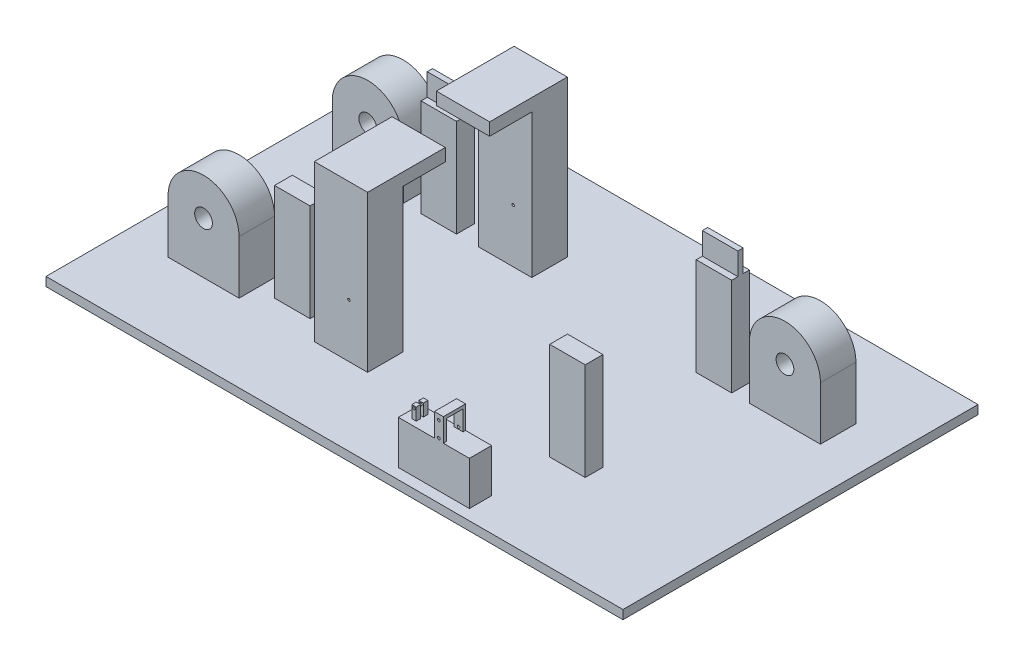
from build123d import *

# Parameters (mm, degrees)
ESQUISSE2_W             = 650
ESQUISSE2_H             = 400
BOSS_EXTRU_1_DEPTH      = 5
ESQUISSE3_W             = 80
ESQUISSE3_H             = 40
BOSS_EXTRU_3_DEPTH      = 100
CONG_2_RADIUS           = 40
CONG_2_LENGTH           = 40
CONG_3_RADIUS           = 40
CONG_3_LENGTH           = 40
CONG_4_RADIUS           = 40
CONG_4_LENGTH           = 40
ESQUISSE6_R             = 10
ENL_V_MAT_EXTRU_2_DEPTH = 463.932230461
ESQUISSE7_R             = 10
ENL_V_MAT_EXTRU_3_DEPTH = 463.932230461
ESQUISSE9_W             = 80
ESQUISSE9_H             = 25
BOSS_EXTRU_4_DEPTH      = 49
ESQUISSE10_W            = 10.1
ESQUISSE10_H            = 3.4
BOSS_EXTRU_5_DEPTH      = 26
ENL_V_MAT_EXTRU_4_REACH = 518.908
ESQUISSE11_R            = 1.5
ESQUISSE12_W            = 10.1
ESQUISSE12_H            = 3.5
BOSS_EXTRU_6_DEPTH      = 21.6
ESQUISSE13_W            = 10.1
ESQUISSE13_H            = 2.8
BOSS_EXTRU_7_DEPTH      = 26
ENL_V_MAT_EXTRU_5_REACH = 500.416
ESQUISSE14_R            = 1.5
ESQUISSE15_W            = 5
ESQUISSE15_H            = 5
BOSS_EXTRU_8_DEPTH      = 13.75
ESQUISSE16_R            = 1.4
ENL_V_MAT_EXTRU_6_DEPTH = 513.19614407
ESQUISSE17_W            = 40
ESQUISSE17_H            = 20
BOSS_EXTRU_9_DEPTH      = 110
ESQUISSE18_W            = 40
ESQUISSE18_H            = 6
BOSS_EXTRU_10_DEPTH     = 25
ESQUISSE20_W            = 60
ESQUISSE20_H            = 40
BOSS_EXTRU_11_DEPTH     = 175.7
BOSS_EXTRU_12_REACH     = 463.014
ESQUISSE21_W            = 60
ESQUISSE21_H            = 14.1
ENL_V_MAT_EXTRU_7_REACH = 426.393
ESQUISSE22_W            = 60
ESQUISSE22_H            = 50


with BuildPart() as part:
    # Esquisse2 → Boss.-Extru.1 (new, symmetric)
    with BuildSketch(Plane(origin=(0, 0, 0), x_dir=(1, 0, 0), z_dir=(0, 1, 0))):
        Rectangle(ESQUISSE2_W, ESQUISSE2_H)
    extrude(amount=BOSS_EXTRU_1_DEPTH, both=True)

    # Esquisse3 → Boss.-Extru.3 (add)
    with BuildSketch(Plane(origin=(0, 5, 0), x_dir=(1, 0, 0), z_dir=(0, 1, 0))):
        with Locations((-235, -92.5)):
            Rectangle(ESQUISSE3_W, ESQUISSE3_H)
        with Locations((235, 92.5)):
            Rectangle(ESQUISSE3_W, ESQUISSE3_H)
        with Locations((-235, 92.5)):
            Rectangle(ESQUISSE3_W, ESQUISSE3_H)
    extrude(amount=BOSS_EXTRU_3_DEPTH)

    # Congé2: full round fillet: the end face becomes a half cylinder, R = half its width
    cong_2_face = Plane((-235, 105, 92.5), x_dir=(0, 0, -1), z_dir=(0, 1, 0))  # on the end face: x along it, z out of the body
    cong_2_slab = cong_2_face.offset(-CONG_2_RADIUS / 2) * Box(CONG_2_LENGTH, 2 * CONG_2_RADIUS, CONG_2_RADIUS, mode=Mode.PRIVATE)  # the body's end, R deep
    cong_2_round = Plane((-235, 65, 92.5), x_dir=(0, 1, 0), z_dir=(0, 0, -1)) * Cylinder(CONG_2_RADIUS, CONG_2_LENGTH, mode=Mode.PRIVATE)  # its axis R under the face
    add(cong_2_slab - cong_2_round, mode=Mode.SUBTRACT)

    # Congé3: full round fillet: the end face becomes a half cylinder, R = half its width
    cong_3_face = Plane((-235, 105, -92.5), x_dir=(0, 0, -1), z_dir=(0, 1, 0))  # on the end face: x along it, z out of the body
    cong_3_slab = cong_3_face.offset(-CONG_3_RADIUS / 2) * Box(CONG_3_LENGTH, 2 * CONG_3_RADIUS, CONG_3_RADIUS, mode=Mode.PRIVATE)  # the body's end, R deep
    cong_3_round = Plane((-235, 65, -92.5), x_dir=(0, 1, 0), z_dir=(0, 0, -1)) * Cylinder(CONG_3_RADIUS, CONG_3_LENGTH, mode=Mode.PRIVATE)  # its axis R under the face
    add(cong_3_slab - cong_3_round, mode=Mode.SUBTRACT)

    # Congé4: full round fillet: the end face becomes a half cylinder, R = half its width
    cong_4_face = Plane((235, 105, -92.5), x_dir=(0, 0, -1), z_dir=(0, 1, 0))  # on the end face: x along it, z out of the body
    cong_4_slab = cong_4_face.offset(-CONG_4_RADIUS / 2) * Box(CONG_4_LENGTH, 2 * CONG_4_RADIUS, CONG_4_RADIUS, mode=Mode.PRIVATE)  # the body's end, R deep
    cong_4_round = Plane((235, 65, -92.5), x_dir=(0, 1, 0), z_dir=(0, 0, -1)) * Cylinder(CONG_4_RADIUS, CONG_4_LENGTH, mode=Mode.PRIVATE)  # its axis R under the face
    add(cong_4_slab - cong_4_round, mode=Mode.SUBTRACT)

    # Esquisse6 → Enlèv. mat.-Extru.2 (cut, through all)
    with BuildSketch(Plane.XY.offset(112.5)):
        with Locations((-235, 63)):
            Circle(ESQUISSE6_R)
    extrude(amount=-ENL_V_MAT_EXTRU_2_DEPTH, mode=Mode.SUBTRACT)

    # Esquisse7 → Enlèv. mat.-Extru.3 (cut, through all)
    with BuildSketch(Plane(origin=(0, 0, -112.5), x_dir=(-1, 0, 0), z_dir=(0, 0, -1))):
        with Locations((-235, 63)):
            Circle(ESQUISSE7_R)
    extrude(amount=-ENL_V_MAT_EXTRU_3_DEPTH, mode=Mode.SUBTRACT)

    # Esquisse9 → Boss.-Extru.4 (add)
    with BuildSketch(Plane(origin=(0, 5, 0), x_dir=(1, 0, 0), z_dir=(0, 1, 0))):
        with Locations((100, -175.5)):
            Rectangle(ESQUISSE9_W, ESQUISSE9_H)
    extrude(amount=BOSS_EXTRU_4_DEPTH)

    # Esquisse10 → Boss.-Extru.5 (add)
    with BuildSketch(Plane(origin=(0, 54, 0), x_dir=(1, 0, 0), z_dir=(0, 1, 0))):
        with Locations((105.62, -186.3)):
            Rectangle(ESQUISSE10_W, ESQUISSE10_H)
    extrude(amount=BOSS_EXTRU_5_DEPTH)

    # Esquisse11 → Enlèv. mat.-Extru.4 (cut, up to next)
    with BuildSketch(Plane.XY.offset(188), mode=Mode.PRIVATE) as enl_v_mat_extru_4_sk1:
        with Locations((105.62, 56.5)):
            Circle(ESQUISSE11_R)
    enl_v_mat_extru_4_tool1 = extrude(enl_v_mat_extru_4_sk1.sketch, amount=-ENL_V_MAT_EXTRU_4_REACH, mode=Mode.PRIVATE) & part.part
    # Esquisse11 → Enlèv. mat.-Extru.4 (cut, up to next)
    with BuildSketch(Plane.XY.offset(188), mode=Mode.PRIVATE) as enl_v_mat_extru_4_sk2:
        with Locations((105.62, 74)):
            Circle(ESQUISSE11_R)
    enl_v_mat_extru_4_tool2 = extrude(enl_v_mat_extru_4_sk2.sketch, amount=-ENL_V_MAT_EXTRU_4_REACH, mode=Mode.PRIVATE) & part.part
    add(enl_v_mat_extru_4_tool1.solids().sort_by_distance((105.62, 56.5, 188))[0], mode=Mode.SUBTRACT)
    add(enl_v_mat_extru_4_tool2.solids().sort_by_distance((105.62, 74, 188))[0], mode=Mode.SUBTRACT)

    # Esquisse12 → Boss.-Extru.6 (add)
    with BuildSketch(Plane(origin=(0, 0, 184.6), x_dir=(-1, 0, 0), z_dir=(0, 0, -1))):
        with Locations((-105.62, 78.25)):
            Rectangle(ESQUISSE12_W, ESQUISSE12_H)
    extrude(amount=BOSS_EXTRU_6_DEPTH)

    # Esquisse13 → Boss.-Extru.7 (add)
    with BuildSketch(Plane(origin=(0, 80, 0), x_dir=(1, 0, 0), z_dir=(0, 1, 0))):
        with Locations((105.62, -164.4)):
            Rectangle(ESQUISSE13_W, ESQUISSE13_H)
    extrude(amount=-BOSS_EXTRU_7_DEPTH)

    # Esquisse14 → Enlèv. mat.-Extru.5 (cut, up to next)
    with BuildSketch(Plane(origin=(0, 0, 163), x_dir=(-1, 0, 0), z_dir=(0, 0, -1)), mode=Mode.PRIVATE) as enl_v_mat_extru_5_sk1:
        with Locations(Location((-105.62, 74, 0), (0, 0, 180))):
            Circle(ESQUISSE14_R)
    enl_v_mat_extru_5_tool1 = extrude(enl_v_mat_extru_5_sk1.sketch, amount=-ENL_V_MAT_EXTRU_5_REACH, mode=Mode.PRIVATE) & part.part
    # Esquisse14 → Enlèv. mat.-Extru.5 (cut, up to next)
    with BuildSketch(Plane(origin=(0, 0, 163), x_dir=(-1, 0, 0), z_dir=(0, 0, -1)), mode=Mode.PRIVATE) as enl_v_mat_extru_5_sk2:
        with Locations(Location((-105.62, 56.5, 0), (0, 0, 180))):
            Circle(ESQUISSE14_R)
    enl_v_mat_extru_5_tool2 = extrude(enl_v_mat_extru_5_sk2.sketch, amount=-ENL_V_MAT_EXTRU_5_REACH, mode=Mode.PRIVATE) & part.part
    add(enl_v_mat_extru_5_tool1.solids().sort_by_distance((105.62, 74, 163))[0], mode=Mode.SUBTRACT)
    add(enl_v_mat_extru_5_tool2.solids().sort_by_distance((105.62, 56.5, 163))[0], mode=Mode.SUBTRACT)

    # Esquisse15 → Boss.-Extru.8 (add)
    with BuildSketch(Plane(origin=(0, 54, 0), x_dir=(1, 0, 0), z_dir=(0, 1, 0))):
        with Locations((71.32, -179.2)):
            Rectangle(ESQUISSE15_W, ESQUISSE15_H)
        with Locations((71.32, -171.2)):
            Rectangle(ESQUISSE15_W, ESQUISSE15_H)
    extrude(amount=BOSS_EXTRU_8_DEPTH)

    # Esquisse16 → Enlèv. mat.-Extru.6 (cut, through all)
    with BuildSketch(Plane.XY.offset(181.7)):
        with Locations((71.22, 65.25)):
            Circle(ESQUISSE16_R)
    enl_v_mat_extru_6 = extrude(amount=-ENL_V_MAT_EXTRU_6_DEPTH, mode=Mode.SUBTRACT)

    # Esquisse17 → Boss.-Extru.9 (add)
    with BuildSketch(Plane(origin=(0, 5, 0), x_dir=(1, 0, 0), z_dir=(0, 1, 0))):
        with Locations((-155, -82.5)):
            Rectangle(ESQUISSE17_W, ESQUISSE17_H)
        with Locations((-155, 82.5)):
            Rectangle(ESQUISSE17_W, ESQUISSE17_H)
    boss_extru_9 = extrude(amount=BOSS_EXTRU_9_DEPTH)

    # Esquisse18 → Boss.-Extru.10 (add)
    with BuildSketch(Plane(origin=(0, 115, 0), x_dir=(1, 0, 0), z_dir=(0, 1, 0))):
        with Locations((-155, 82.5)):
            Rectangle(ESQUISSE18_W, ESQUISSE18_H)
    boss_extru_10 = extrude(amount=BOSS_EXTRU_10_DEPTH)

    # Esquisse20 → Boss.-Extru.11 (add)
    with BuildSketch(Plane(origin=(0, 5, 0), x_dir=(1, 0, 0), z_dir=(0, 1, 0))):
        with Locations((-80.1874064, -92.5)):
            Rectangle(ESQUISSE20_W, ESQUISSE20_H)
        with Locations((-80.1874064, 92.5)):
            Rectangle(ESQUISSE20_W, ESQUISSE20_H)
    extrude(amount=BOSS_EXTRU_11_DEPTH)

    # Esquisse21 → Boss.-Extru.12 (add, up to next)
    with BuildSketch(Plane.XY.offset(-72.5), mode=Mode.PRIVATE) as boss_extru_12_sk1:
        with Locations((-80.1874064, 173.65)):
            Rectangle(ESQUISSE21_W, ESQUISSE21_H)
    boss_extru_12_tool1 = extrude(boss_extru_12_sk1.sketch, amount=BOSS_EXTRU_12_REACH, mode=Mode.PRIVATE) - part.part
    add(boss_extru_12_tool1.solids().sort_by_distance((-80.187406, 173.65, -72.5))[0])

    # Esquisse22 → Enlèv. mat.-Extru.7 (cut, up to next)
    with BuildSketch(Plane(origin=(0, 180.7, 0), x_dir=(1, 0, 0), z_dir=(0, 1, 0)), mode=Mode.PRIVATE) as enl_v_mat_extru_7_sk1:
        with Locations((-80.1874064, 0)):
            Rectangle(ESQUISSE22_W, ESQUISSE22_H)
    enl_v_mat_extru_7_tool1 = extrude(enl_v_mat_extru_7_sk1.sketch, amount=-ENL_V_MAT_EXTRU_7_REACH, mode=Mode.PRIVATE) & part.part
    add(enl_v_mat_extru_7_tool1.solids().sort_by_distance((-80.187406, 180.7, 0))[0], mode=Mode.SUBTRACT)

    # Symétrie1: Enlèv. mat.-Extru.6, Boss.-Extru.9, Boss.-Extru.10 across plane
    add(enl_v_mat_extru_6.mirror(Plane(origin=(0, 0, 0), x_dir=(0, 0, 1), z_dir=(1, 0, 0))), mode=Mode.SUBTRACT)
    add(boss_extru_9.mirror(Plane(origin=(0, 0, 0), x_dir=(0, 0, 1), z_dir=(1, 0, 0))))
    add(boss_extru_10.mirror(Plane(origin=(0, 0, 0), x_dir=(0, 0, 1), z_dir=(1, 0, 0))))


solid = part.part
